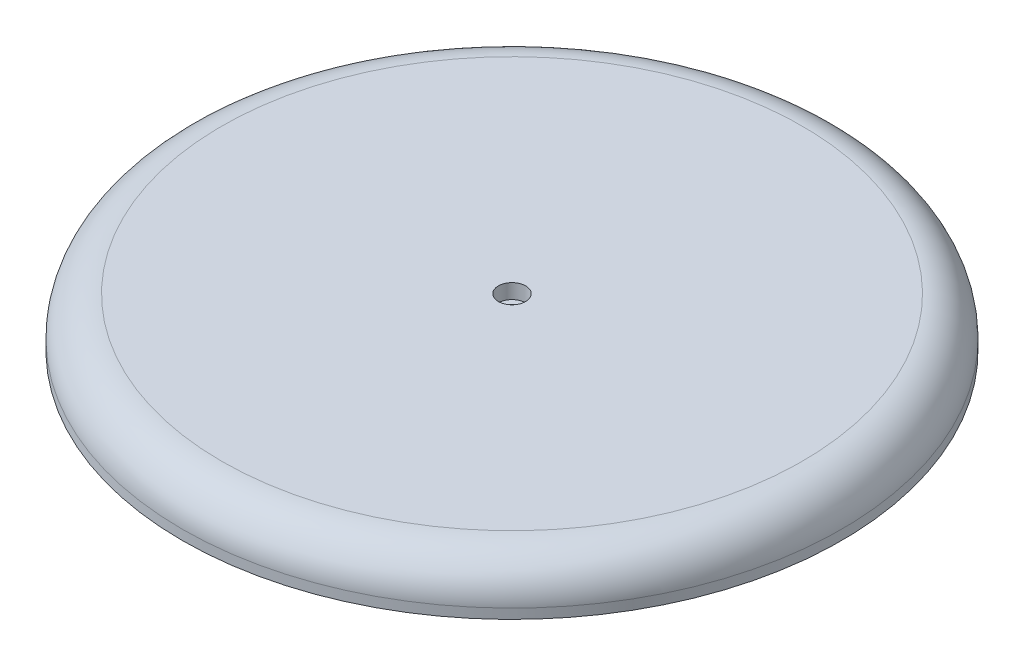
from build123d import *

# Parameters (mm, degrees)
SKETCH1_R           = 67.15
BOSS_EXTRUDE1_DEPTH = 10
SKETCH1_3_R         = 30.48
BOSS_EXTRUDE2_DEPTH = 2
FILLET1_R           = 8
SKETCH2_R           = 2.775
CUT_EXTRUDE1_DEPTH  = 3
CUT_EXTRUDE2_REACH  = 97.39
SKETCH3_R           = 1.6


with BuildPart() as part:
    # Sketch1 → Boss-Extrude1 (new body)
    with BuildSketch(Plane(origin=(0, 0, 0), x_dir=(1, 0, 0), z_dir=(0, 1, 0))):
        Circle(SKETCH1_R)
    extrude(amount=BOSS_EXTRUDE1_DEPTH)

    # Sketch1<3> → Boss-Extrude2 (add)
    with BuildSketch(Plane(origin=(0, 0, 0), x_dir=(1, 0, 0), z_dir=(0, 1, 0))):
        Circle(SKETCH1_3_R)
    extrude(amount=-BOSS_EXTRUDE2_DEPTH)

    # Fillet1
    fillet1_edges = [part.edges().sort_by_distance(p)[0] for p in [
        (-67.15, 10, 0),
    ]]
    fillet(fillet1_edges, radius=FILLET1_R)

    # Sketch2 → Cut-Extrude1 (cut)
    with BuildSketch(Plane(origin=(0, 10, 0), x_dir=(1, 0, 0), z_dir=(0, 1, 0))):
        Circle(SKETCH2_R)
    extrude(amount=-CUT_EXTRUDE1_DEPTH, mode=Mode.SUBTRACT)

    # Sketch3 → Cut-Extrude2 (cut, up to next)
    with BuildSketch(Plane(origin=(0, 7, 0), x_dir=(1, 0, 0), z_dir=(0, 1, 0)), mode=Mode.PRIVATE) as cut_extrude2_sk1:
        Circle(SKETCH3_R)
    cut_extrude2_tool1 = extrude(cut_extrude2_sk1.sketch, amount=-CUT_EXTRUDE2_REACH, mode=Mode.PRIVATE) & part.part
    add(cut_extrude2_tool1.solids().sort_by_distance((0, 7, 0))[0], mode=Mode.SUBTRACT)


solid = part.part
